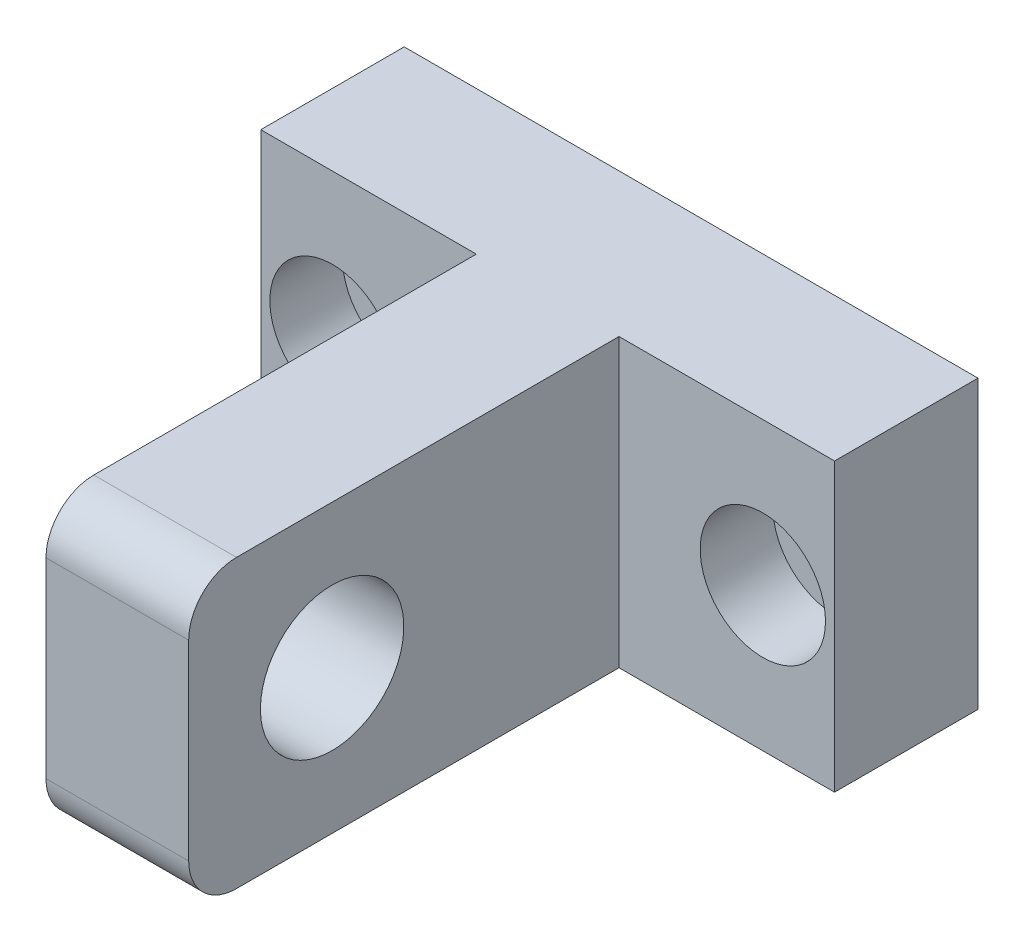
from build123d import *

# Parameters (mm, degrees)
SKETCH1_W                = 38.1
SKETCH1_H                = 19.05
SKETCH1_R                = 2.53365
BOSS_EXTRUDE1_DEPTH      = 9.525
SKETCH2_R                = 4.16052
CUT_EXTRUDE1_DEPTH       = 4.826
BOSS_EXTRUDE2_DEPTH      = 4.7371
BOSS_EXTRUDE2_DEPTH_BACK = 4.7371
SKETCH3_W                = 28.575
SKETCH3_H                = 19.05
SKETCH3_R                = 4.7625
FILLET1_R                = 3.175


with BuildPart() as part:
    # Sketch1 → Boss-Extrude1 (new body)
    with BuildSketch(Plane.XY):
        Rectangle(SKETCH1_W, SKETCH1_H)
        with Locations(Location((-14.2875, 0, 0), (0, 0, 180))):
            Circle(SKETCH1_R, mode=Mode.SUBTRACT)
        with Locations(Location((14.2875, 0, 0), (0, 0, 180))):
            Circle(SKETCH1_R, mode=Mode.SUBTRACT)
    extrude(amount=BOSS_EXTRUDE1_DEPTH)

    # Sketch2 → Cut-Extrude1 (cut)
    with BuildSketch(Plane.XY.offset(9.525)):
        with Locations((-14.2875, 0)):
            Circle(SKETCH2_R)
        with Locations((14.2875, 0)):
            Circle(SKETCH2_R)
    extrude(amount=-CUT_EXTRUDE1_DEPTH, mode=Mode.SUBTRACT)

    # Sketch3 → Boss-Extrude2 (add, two sides: drawn at the far end of the back side and taken through both)
    with BuildSketch(Plane(origin=(0, 0, 0), x_dir=(0, 0, -1), z_dir=(1, 0, 0)).offset(-BOSS_EXTRUDE2_DEPTH_BACK)):
        with Locations((-23.8125, 0)):
            Rectangle(SKETCH3_W, SKETCH3_H)
        with Locations(Location((-28.575, 0, 0), (0, 0, 180))):
            Circle(SKETCH3_R, mode=Mode.SUBTRACT)
    extrude(amount=BOSS_EXTRUDE2_DEPTH + BOSS_EXTRUDE2_DEPTH_BACK)

    # Fillet1
    fillet1_edges = [part.edges().sort_by_distance(p)[0] for p in [
        (0, -9.525, 38.1),
        (0, 9.525, 38.1),
    ]]
    fillet(fillet1_edges, radius=FILLET1_R)


solid = part.part
